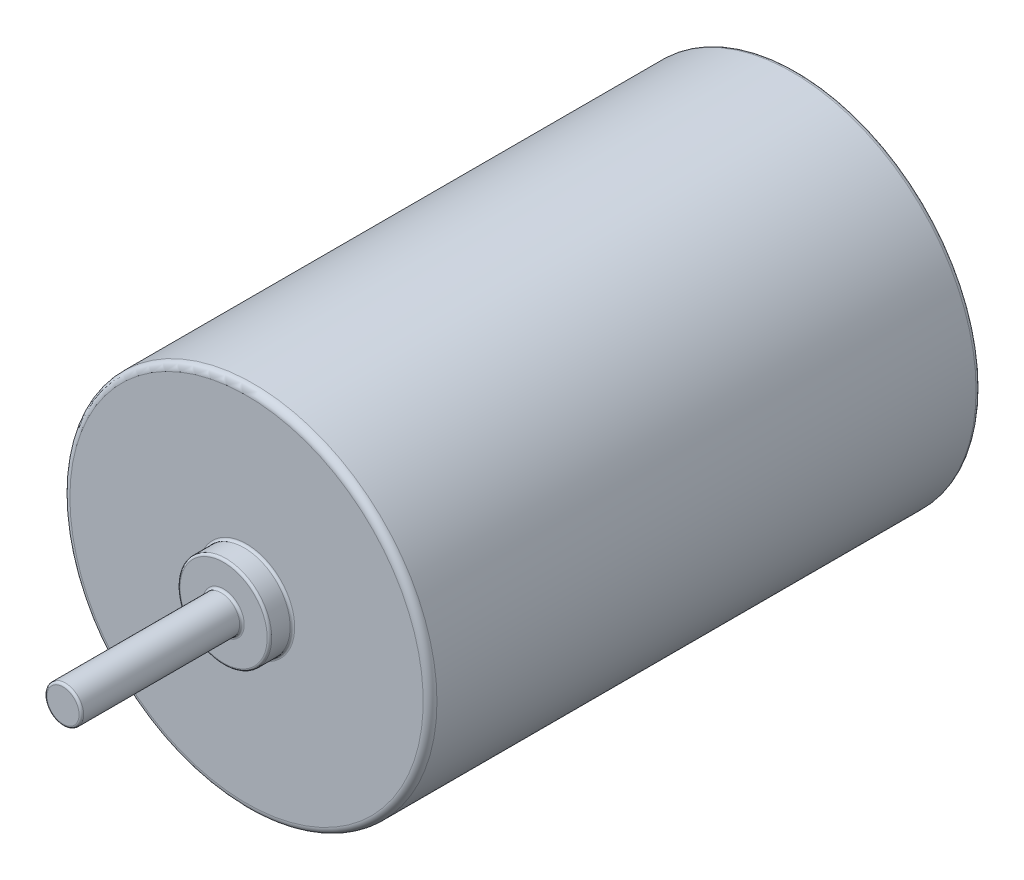
from build123d import *

# Parameters (mm, degrees)
FILLET1_R = 0.05
FILLET3_R = 0.15
FILLET4_R = 0.1


with BuildPart() as part:
    # Sketch1 → Revolve1 (revolve)
    with BuildSketch(Plane(origin=(0, 0, 0), x_dir=(0, 0, -1), z_dir=(1, 0, 0)), mode=Mode.PRIVATE) as revolve1_sk:
        Polygon((0, 4), (12, 4), (12, 0), (-4, 0), (-4, 0.4), (-0.5, 0.4), (-0.5, 1), (0, 1), align=None)
    revolve(revolve1_sk.sketch.rotate(Axis((0, 0, 94.83033259), (0, 0, -1)), 90), axis=Axis((0, 0, 94.83033259), (0, 0, -1)))

    # Fillet1
    fillet1_edges = [part.edges().sort_by_distance(p)[0] for p in [
        (-1, 0, 0),
        (-1, 0, 0.5),
        (-0.4, 0, 0.5),
        (-0.4, 0, 4),
    ]]
    fillet(fillet1_edges, radius=FILLET1_R)

    # Fillet3
    fillet3_edges = [part.edges().sort_by_distance(p)[0] for p in [
        (-4, 0, 0),
    ]]
    fillet(fillet3_edges, radius=FILLET3_R)

    # Fillet4
    fillet4_edges = [part.edges().sort_by_distance(p)[0] for p in [
        (-4, 0, -12),
    ]]
    fillet(fillet4_edges, radius=FILLET4_R)


solid = part.part
